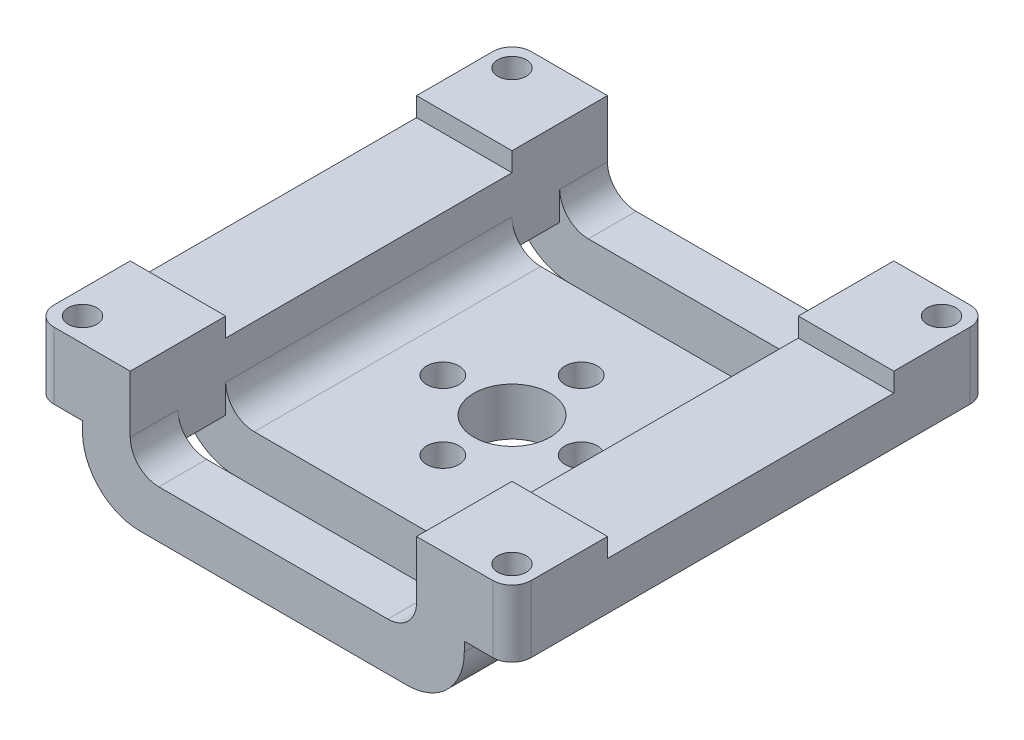
from build123d import *

# Parameters (mm, degrees)
EXTRUDE_1_DEPTH     = 50
SKETCH_2_R          = 4
SKETCH_2_R_2        = 1.7
CUT_EXTRUDE_1_DEPTH = 50
SKETCH_3_W          = 10
SKETCH_3_H          = 10
EXTRUDE_2_DEPTH     = 2
FILLET_1_R          = 6
FILLET_2_R          = 6
FILLET_3_R          = 3
FILLET_4_R          = 3
SKETCH_5_R          = 1.5
CUT_EXTRUDE_2_DEPTH = 23
FILLET_5_R          = 2
FILLET_6_R          = 2
FILLET_7_R          = 2
FILLET_8_R          = 2
SKETCH_7_W          = 44.35766487
SKETCH_7_H          = 5
CUT_EXTRUDE_4_DEPTH = 5
CUT_EXTRUDE_5_DEPTH = 31


with BuildPart() as part:
    # 草图1 → 凸台-拉伸1 (new body)
    with BuildSketch(Plane.XY):
        Polygon((-45, 4.380640832), (-35, 4.380640832), (-35, -2.619359168), (-5, -2.619359168), (-5, 4.380640832), (5, 4.380640832), (5, -0.619359168), (0, -0.619359168), (0, -7.619359168), (-40, -7.619359168), (-40, -0.619359168), (-45, -0.619359168), align=None)
    extrude(amount=EXTRUDE_1_DEPTH)

    # 草图2 → 切除-拉伸1 (cut)
    with BuildSketch(Plane(origin=(0, -2.619359168, 0), x_dir=(1, 0, 0), z_dir=(0, 1, 0))):
        with Locations(Location((-20, -25, 0), (0, 0, 270))):
            Circle(SKETCH_2_R)
        with Locations(Location((-20, -17.75, 0), (0, 0, 270))):
            Circle(SKETCH_2_R_2)
        with Locations(Location((-12.75, -25, 0), (0, 0, 270))):
            Circle(SKETCH_2_R_2)
        with Locations(Location((-20, -32.25, 0), (0, 0, 270))):
            Circle(SKETCH_2_R_2)
        with Locations(Location((-27.25, -25, 0), (0, 0, 270))):
            Circle(SKETCH_2_R_2)
    extrude(amount=-CUT_EXTRUDE_1_DEPTH, mode=Mode.SUBTRACT)

    # 草图3 → 凸台-拉伸2 (add)
    with BuildSketch(Plane(origin=(0, 4.380640832, 0), x_dir=(1, 0, 0), z_dir=(0, 1, 0))):
        with Locations((0, -45)):
            Rectangle(SKETCH_3_W, SKETCH_3_H)
        with Locations((-40, -45)):
            Rectangle(SKETCH_3_W, SKETCH_3_H)
        with Locations((-40, -5)):
            Rectangle(SKETCH_3_W, SKETCH_3_H)
        with Locations((0, -5)):
            Rectangle(SKETCH_3_W, SKETCH_3_H)
    extrude(amount=EXTRUDE_2_DEPTH)

    # 圆角1
    fillet_1_edges = [part.edges().sort_by_distance(p)[0] for p in [
        (-40, -7.619359168, 25),
    ]]
    fillet(fillet_1_edges, radius=FILLET_1_R)

    # 圆角2
    fillet_2_edges = [part.edges().sort_by_distance(p)[0] for p in [
        (0, -7.619359168, 25),
    ]]
    fillet(fillet_2_edges, radius=FILLET_2_R)

    # 圆角3
    fillet_3_edges = [part.edges().sort_by_distance(p)[0] for p in [
        (-5, -2.619359168, 25),
    ]]
    fillet(fillet_3_edges, radius=FILLET_3_R)

    # 圆角4
    fillet_4_edges = [part.edges().sort_by_distance(p)[0] for p in [
        (-35, -2.619359168, 25),
    ]]
    fillet(fillet_4_edges, radius=FILLET_4_R)

    # 草图5 → 切除-拉伸2 (cut)
    with BuildSketch(Plane.XZ.offset(0.619359168)):
        with Locations((2.5, 47.5)):
            Circle(SKETCH_5_R)
        with Locations(Location((2.5, 2.5, 0), (0, 0, 270))):
            Circle(SKETCH_5_R)
        with Locations((-42.5, 2.5)):
            Circle(SKETCH_5_R)
        with Locations(Location((-42.5, 47.5, 0), (0, 0, 270))):
            Circle(SKETCH_5_R)
    extrude(amount=-CUT_EXTRUDE_2_DEPTH, mode=Mode.SUBTRACT)

    # 圆角5
    fillet_5_edges = [part.edges().sort_by_distance(p)[0] for p in [
        (5, 2.880640832, 50),
    ]]
    fillet(fillet_5_edges, radius=FILLET_5_R)

    # 圆角6
    fillet_6_edges = [part.edges().sort_by_distance(p)[0] for p in [
        (5, 2.880640832, 0),
    ]]
    fillet(fillet_6_edges, radius=FILLET_6_R)

    # 圆角7
    fillet_7_edges = [part.edges().sort_by_distance(p)[0] for p in [
        (-45, 2.880640832, 0),
    ]]
    fillet(fillet_7_edges, radius=FILLET_7_R)

    # 圆角8
    fillet_8_edges = [part.edges().sort_by_distance(p)[0] for p in [
        (-45, 2.880640832, 50),
    ]]
    fillet(fillet_8_edges, radius=FILLET_8_R)

    # 草图7 → 切除-拉伸4 (cut)
    with BuildSketch(Plane.XZ.offset(7.619359168)):
        with Locations((-20.290282059, 42.5)):
            Rectangle(SKETCH_7_W, SKETCH_7_H)
        with Locations((-20.290282059, 7.5)):
            Rectangle(SKETCH_7_W, SKETCH_7_H)
    extrude(amount=-CUT_EXTRUDE_4_DEPTH, mode=Mode.SUBTRACT)

    # 草图8 → 切除-拉伸5 (cut)
    with BuildSketch(Plane(origin=(0, 6.380640832, 0), x_dir=(1, 0, 0), z_dir=(0, 1, 0))):
        Polygon((-5, -40), (-8, -40), (-35, -40), (-35, -45), (-5, -45), align=None)
        Polygon((-35, -10), (-8, -10), (-5, -10), (-5, -5), (-35, -5), align=None)
    extrude(amount=-CUT_EXTRUDE_5_DEPTH, mode=Mode.SUBTRACT)


solid = part.part
